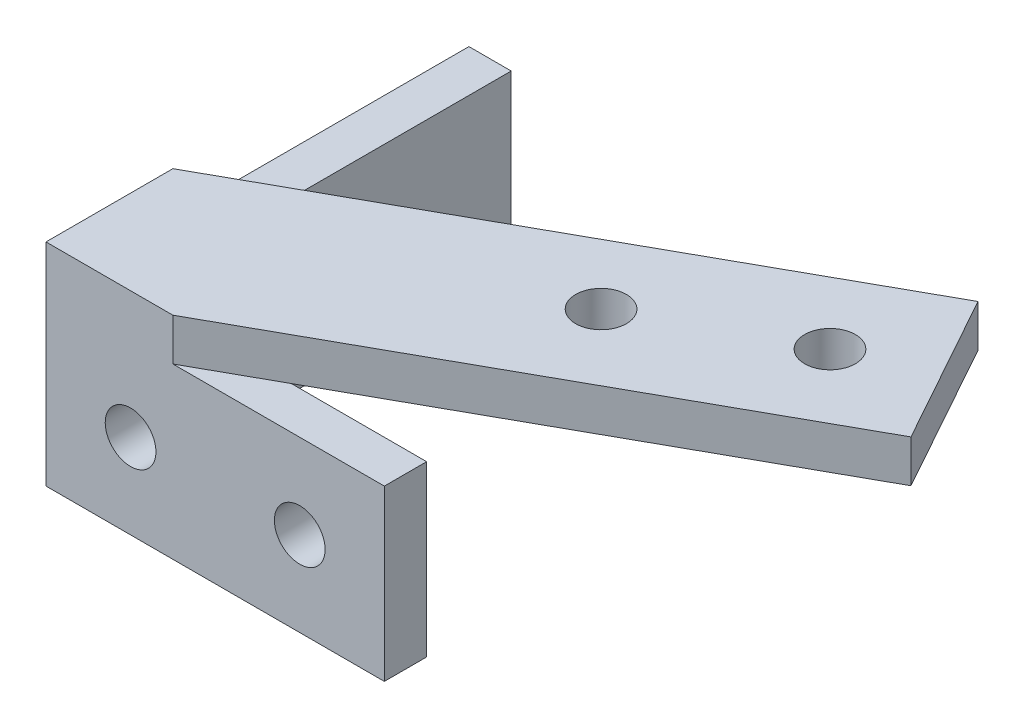
from build123d import *

# Parameters (mm, degrees)
BOSS_EXTRUDE1_DEPTH = 20
BOSS_EXTRUDE5_DEPTH = 5
SKETCH12_R          = 3
CUT_EXTRUDE7_DEPTH  = 88.776628115
SKETCH13_R          = 3
CUT_EXTRUDE8_DEPTH  = 87.566562518
SKETCH14_R          = 3
CUT_EXTRUDE9_DEPTH  = 91.441895398


with BuildPart() as part:
    # Sketch1 → Boss-Extrude1 (new body)
    with BuildSketch(Plane(origin=(0, 0, 0), x_dir=(1, 0, 0), z_dir=(0, 1, 0))):
        Polygon((0, 50), (0, 0), (40, 0), (40, 5), (5, 5), (5, 50), align=None)
    extrude(amount=BOSS_EXTRUDE1_DEPTH)

    # Sketch11 → Boss-Extrude5 (add)
    with BuildSketch(Plane(origin=(0, 20, 0), x_dir=(1, 0, 0), z_dir=(0, 1, 0))):
        Polygon((0, 0), (0, 15), (61.191009328, 48.995005183), (71.096669706, 31.164816504), (15, 0), align=None)
    extrude(amount=BOSS_EXTRUDE5_DEPTH)

    # Sketch12 → Cut-Extrude7 (cut, through all)
    with BuildSketch(Plane(origin=(0, 0, -5), x_dir=(-1, 0, 0), z_dir=(0, 0, -1))):
        with Locations((-10, 10)):
            Circle(SKETCH12_R)
        with Locations((-30, 10)):
            Circle(SKETCH12_R)
    extrude(amount=-CUT_EXTRUDE7_DEPTH, mode=Mode.SUBTRACT)

    # Sketch13 → Cut-Extrude8 (cut, through all)
    with BuildSketch(Plane(origin=(5, 0, 0), x_dir=(0, 0, -1), z_dir=(1, 0, 0))):
        with Locations((15, 10)):
            Circle(SKETCH13_R)
        with Locations((35, 10)):
            Circle(SKETCH13_R)
    extrude(amount=-CUT_EXTRUDE8_DEPTH, mode=Mode.SUBTRACT)

    # Sketch14 → Cut-Extrude9 (cut, through all)
    with BuildSketch(Plane(origin=(0, 25, 0), x_dir=(1, 0, 0), z_dir=(0, 1, 0))):
        with Locations((57.323641314, 35.365007327)):
            Circle(SKETCH14_R)
        with Locations((39.685556362, 25.936435896)):
            Circle(SKETCH14_R)
    extrude(amount=-CUT_EXTRUDE9_DEPTH, mode=Mode.SUBTRACT)


solid = part.part
